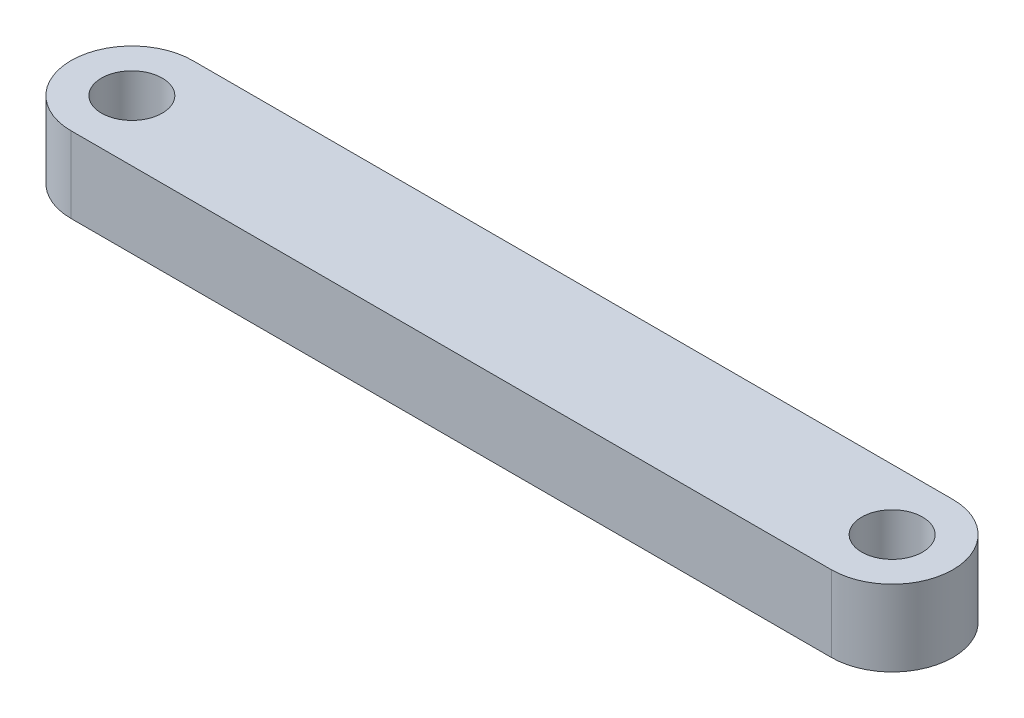
from build123d import *

# Parameters (mm, degrees)
SKETCH_1_R      = 2
EXTRUDE_1_DEPTH = 5


with BuildPart() as part:
    # 草圖1 → 填料-伸長1 (new body)
    with BuildSketch(Plane(origin=(0, 0, 0), x_dir=(1, 0, 0), z_dir=(0, 1, 0))):
        with BuildLine():
            Line((-25, 4), (25, 4))
            ThreePointArc((25, 4), (29, 0), (25, -4))
            Line((25, -4), (-25, -4))
            ThreePointArc((-25, -4), (-29, 0), (-25, 4))
        make_face()
        with Locations(Location((-25, 0, 0), (0, 0, 270))):
            Circle(SKETCH_1_R, mode=Mode.SUBTRACT)
        with Locations(Location((25, 0, 0), (0, 0, 270))):
            Circle(SKETCH_1_R, mode=Mode.SUBTRACT)
    extrude(amount=EXTRUDE_1_DEPTH)


solid = part.part
